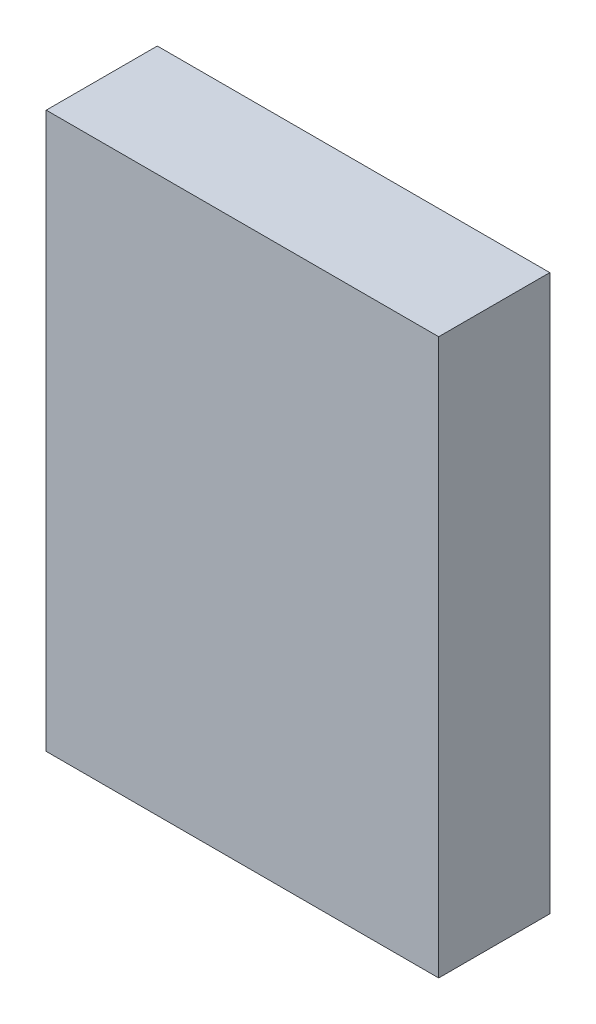
from build123d import *

# Parameters (mm, degrees)
ESQUISSE1_W        = 53
ESQUISSE1_H        = 75
BOSS_EXTRU_1_DEPTH = 15


with BuildPart() as part:
    # Esquisse1 → Boss.-Extru.1 (new body)
    with BuildSketch(Plane.XY):
        with Locations((26.5, 37.5)):
            Rectangle(ESQUISSE1_W, ESQUISSE1_H)
    extrude(amount=BOSS_EXTRU_1_DEPTH)


solid = part.part
